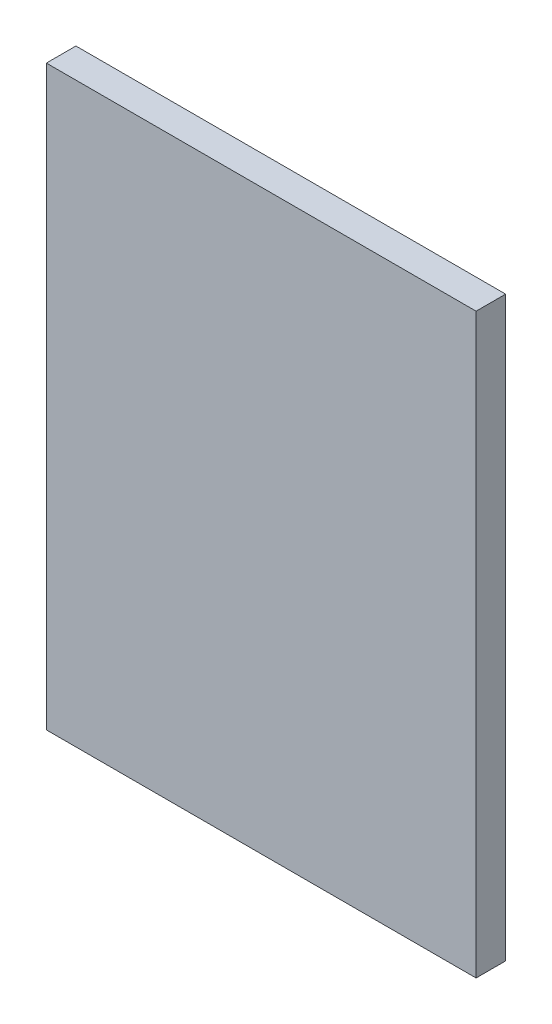
from build123d import *

# Parameters (mm, degrees)
SKETCH1_W      = 34.9
SKETCH1_H      = 46.9
ENVELOPE_DEPTH = 2.4


with BuildPart() as part:
    # Sketch1 → Envelope (new body)
    with BuildSketch(Plane.XY):
        Rectangle(SKETCH1_W, SKETCH1_H)
    extrude(amount=ENVELOPE_DEPTH)


solid = part.part
